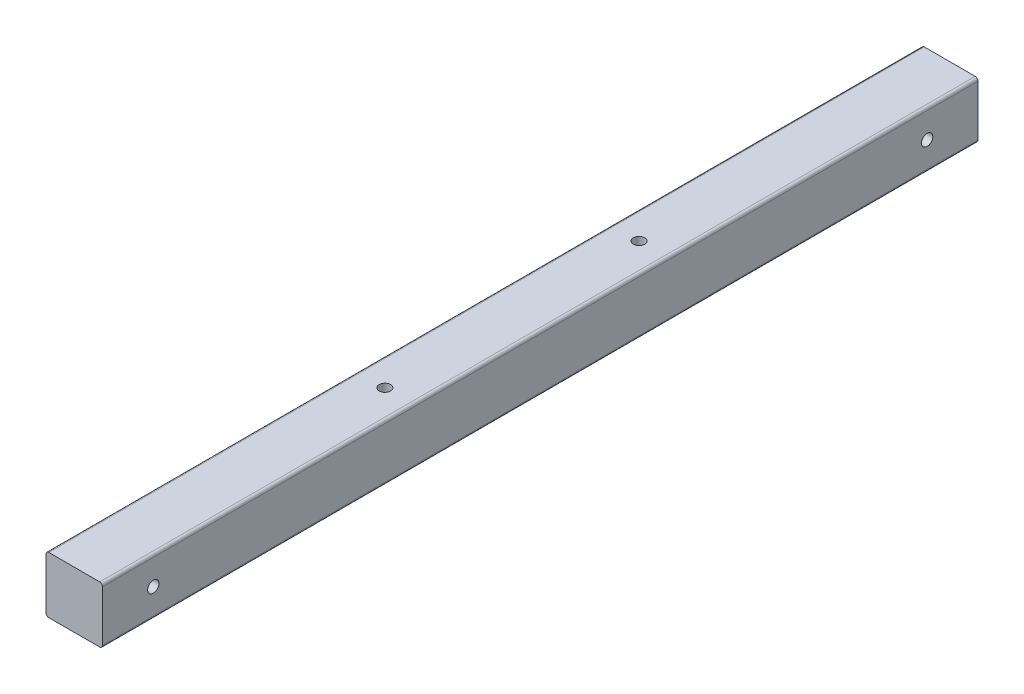
from build123d import *

# Parameters (mm, degrees)
SKETCH_1_W          = 20
SKETCH_1_H          = 20
EXTRUDE_1_DEPTH     = 310
FILLET_1_R          = 1
SKETCH_2_R          = 2
CUT_EXTRUDE_1_DEPTH = 310
SKETCH_3_R          = 2
CUT_EXTRUDE_2_DEPTH = 310


with BuildPart() as part:
    # 草图1 → 凸台-拉伸1 (new body)
    with BuildSketch(Plane.XY):
        with Locations((10, 10)):
            Rectangle(SKETCH_1_W, SKETCH_1_H)
    extrude(amount=EXTRUDE_1_DEPTH)

    # 圆角1
    fillet_1_edges = [part.edges().sort_by_distance(p)[0] for p in [
        (0, 20, 155),
        (20, 20, 155),
        (20, 0, 155),
        (0, 0, 155),
    ]]
    fillet(fillet_1_edges, radius=FILLET_1_R)

    # 草图2 → 切除-拉伸1 (cut)
    with BuildSketch(Plane(origin=(0, 20, 0), x_dir=(1, 0, 0), z_dir=(0, 1, 0))):
        with Locations(Location((10, -110, 0), (0, 0, 270))):
            Circle(SKETCH_2_R)
        with Locations(Location((10, -200, 0), (0, 0, 270))):
            Circle(SKETCH_2_R)
    extrude(amount=-CUT_EXTRUDE_1_DEPTH, mode=Mode.SUBTRACT)

    # 草图3 → 切除-拉伸2 (cut)
    with BuildSketch(Plane.ZY):
        with Locations((18, 10)):
            Circle(SKETCH_3_R)
        with Locations((292, 10)):
            Circle(SKETCH_3_R)
    extrude(amount=-CUT_EXTRUDE_2_DEPTH, mode=Mode.SUBTRACT)


solid = part.part
